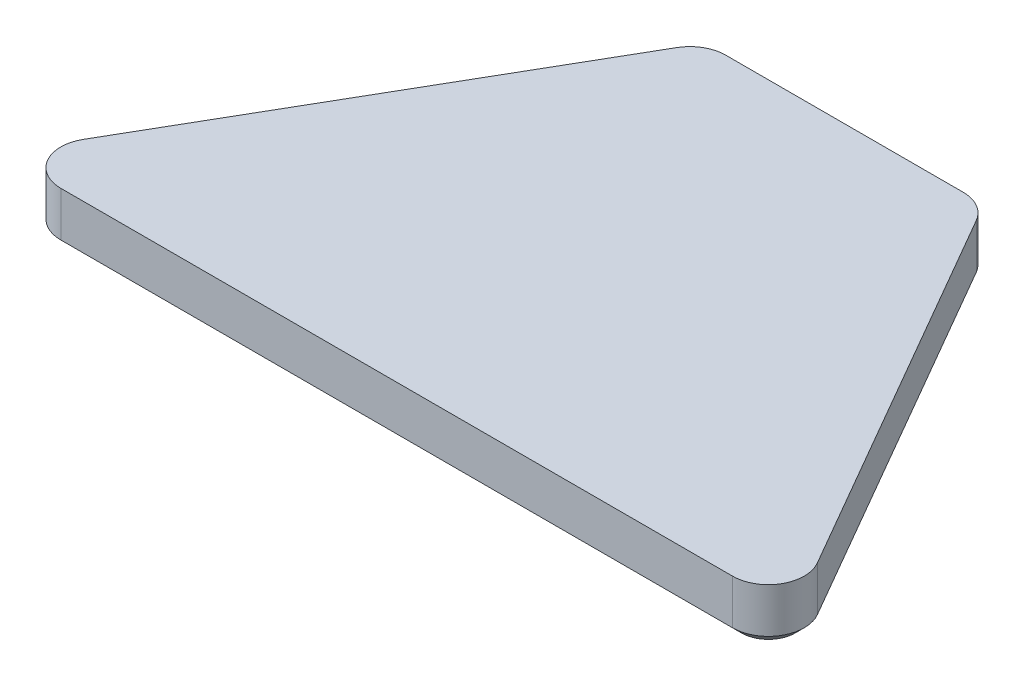
from build123d import *

# Parameters (mm, degrees)
BOSS_EXTRUDE1_DEPTH = 1.5
FILLET5_R           = 2
CHAMFER1_SIZE       = 0.5


with BuildPart() as part:
    # Sketch1 → Boss-Extrude1 (new, symmetric)
    with BuildSketch(Plane(origin=(0, 0, 0), x_dir=(1, 0, 0), z_dir=(0, 1, 0))):
        Polygon((-14.297771125, -12.5), (14.297771125, -12.5), (22.216878365, -12.5), (7.783121635, 12.5), (-7.783121635, 12.5), (-22.216878365, -12.5), align=None)
    extrude(amount=BOSS_EXTRUDE1_DEPTH, both=True)

    # Fillet5
    fillet5_edges = [part.edges().sort_by_distance(p)[0] for p in [
        (-22.216878365, 0, 12.5),
        (-7.783121635, 0, -12.5),
        (7.783121635, 0, -12.5),
        (22.216878365, 0, 12.5),
    ]]
    fillet(fillet5_edges, radius=FILLET5_R)

    # Chamfer1
    chamfer1_edges = [part.edges().sort_by_distance(p)[0] for p in [
        (-14.422649731, -1.5, -1),
        (0, -1.5, 12.5),
        (0, -1.5, -12.5),
        (14.422649731, -1.5, -1),
        (-20.484827557, -1.5, 11.5),
        (20.484827557, -1.5, 11.5),
        (7.628421097, -1.5, -12.232050808),
        (-7.628421097, -1.5, -12.232050808),
    ]]
    chamfer(chamfer1_edges, length=CHAMFER1_SIZE)


solid = part.part
